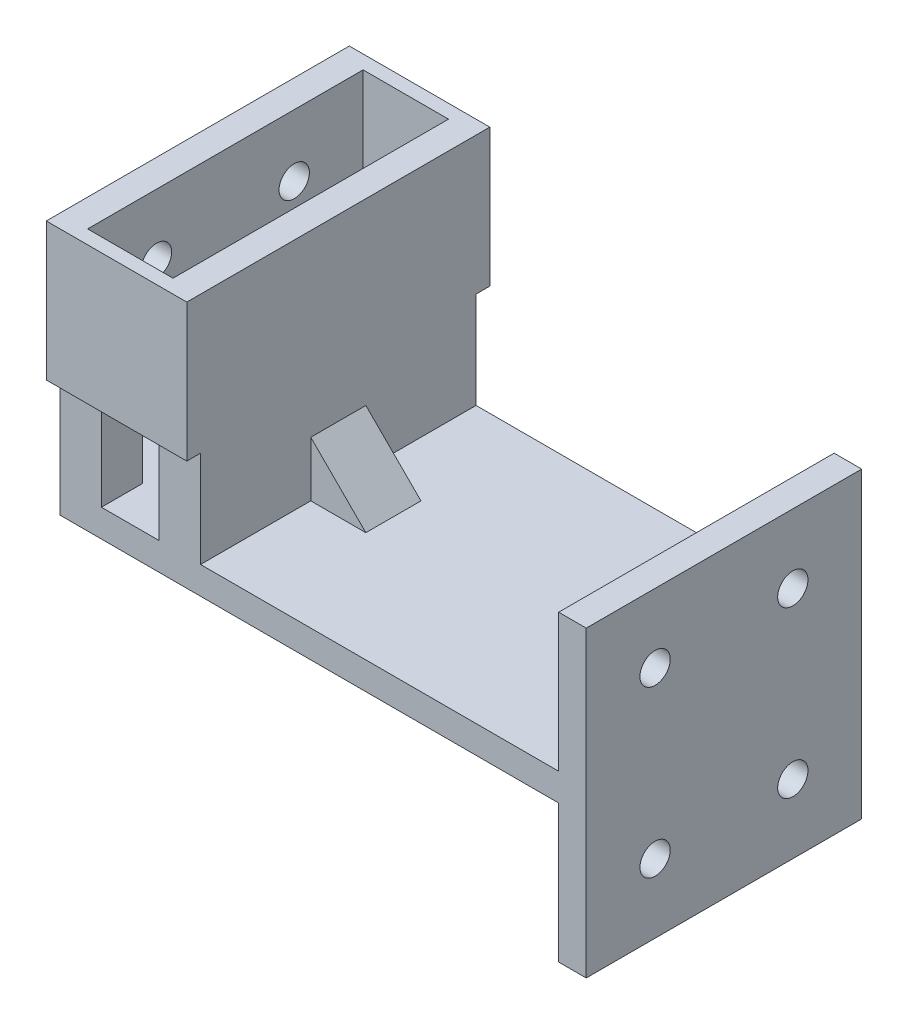
from build123d import *

# Parameters (mm, degrees)
BOSS_EXTRUDE1_DEPTH = 10
SKETCH2_W           = 14
SKETCH2_H           = 4
CUT_EXTRUDE1_DEPTH  = 3
SKETCH13_R          = 1.1
CUT_EXTRUDE4_DEPTH  = 5
SKETCH14_W          = 2
SKETCH14_H          = 20
BOSS_EXTRUDE2_DEPTH = 10
BOSS_EXTRUDE3_DEPTH = 2
SKETCH17_R          = 1.1
CUT_EXTRUDE5_DEPTH  = 4
SKETCH18_W          = 10.2
SKETCH18_H          = 1
BOSS_EXTRUDE4_DEPTH = 10


with BuildPart() as part:
    # Sketch1 → Boss-Extrude1 (new, symmetric)
    with BuildSketch(Plane.XY):
        Polygon((0, 11), (0, -8), (8.2, -8), (38.2, -8), (38.2, -6), (38.2, 4), (36.2, 4), (36.2, -6), (10.2, -6), (10.2, 11), (8.2, 11), (8.2, 2), (7.2, 2), (7.2, -6), (3, -6), (3, 2), (2, 2), (2, 11), align=None)
    extrude(amount=BOSS_EXTRUDE1_DEPTH, both=True)

    # Sketch2 → Cut-Extrude1 (cut)
    with BuildSketch(Plane.ZY):
        with Locations((0, -4)):
            Rectangle(SKETCH2_W, SKETCH2_H)
    extrude(amount=-CUT_EXTRUDE1_DEPTH, mode=Mode.SUBTRACT)

    # Sketch13 → Cut-Extrude4 (cut)
    with BuildSketch(Plane.ZY):
        with Locations(Location((-5, 6.5, 0), (0, 0, 270))):
            Circle(SKETCH13_R)
        with Locations(Location((5, 6.5, 0), (0, 0, 270))):
            Circle(SKETCH13_R)
    extrude(amount=-CUT_EXTRUDE4_DEPTH, mode=Mode.SUBTRACT)

    # Sketch14 → Boss-Extrude2 (add)
    with BuildSketch(Plane.XZ.offset(8)):
        with Locations((37.2, 0)):
            Rectangle(SKETCH14_W, SKETCH14_H)
    extrude(amount=BOSS_EXTRUDE2_DEPTH)

    # Sketch15 → Boss-Extrude3 (add, symmetric)
    with BuildSketch(Plane.XY):
        Polygon((14.2, -6), (10.2, -6), (10.2, -2), align=None)
        Polygon((36.2, -6), (36.2, -2), (32.2, -6), align=None)
        Polygon((36.2, -8), (32.2, -8), (36.2, -12), align=None)
    extrude(amount=BOSS_EXTRUDE3_DEPTH, both=True)

    # Sketch17 → Cut-Extrude5 (cut)
    with BuildSketch(Plane(origin=(38.2, 0, 0), x_dir=(0, 0, -1), z_dir=(1, 0, 0))):
        with Locations((-5, -1)):
            Circle(SKETCH17_R)
        with Locations((5, -1)):
            Circle(SKETCH17_R)
        with Locations((-5, -13)):
            Circle(SKETCH17_R)
        with Locations((5, -13)):
            Circle(SKETCH17_R)
    extrude(amount=-CUT_EXTRUDE5_DEPTH, mode=Mode.SUBTRACT)

    # Sketch18 → Boss-Extrude4 (add)
    with BuildSketch(Plane(origin=(0, 11, 0), x_dir=(1, 0, 0), z_dir=(0, 1, 0))):
        with Locations((5.1, -10.5)):
            Rectangle(SKETCH18_W, SKETCH18_H)
        with Locations((5.1, 10.5)):
            Rectangle(SKETCH18_W, SKETCH18_H)
    extrude(amount=-BOSS_EXTRUDE4_DEPTH)


solid = part.part
